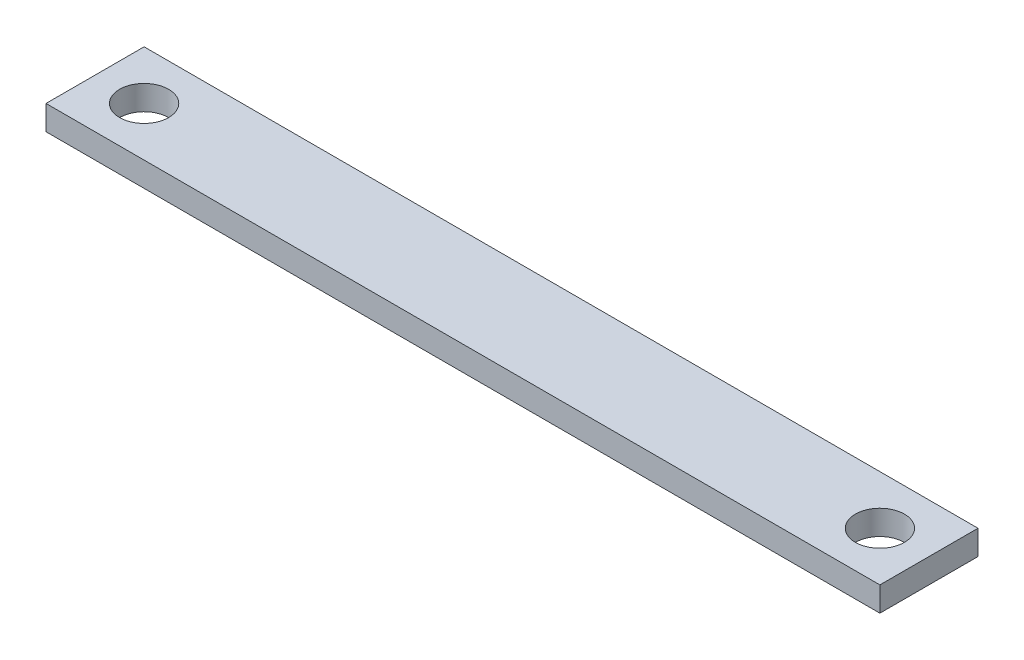
from build123d import *

# Parameters (mm, degrees)
SKETCH1_W           = 215.9
SKETCH1_H           = 25.4
SKETCH1_R           = 6.35
BOSS_EXTRUDE1_DEPTH = 6.35


with BuildPart() as part:
    # Sketch1 → Boss-Extrude1 (new body)
    with BuildSketch(Plane(origin=(0, 0, 0), x_dir=(1, 0, 0), z_dir=(0, 1, 0))):
        Rectangle(SKETCH1_W, SKETCH1_H)
        with Locations(Location((-95.25, 0, 0), (0, 0, 270))):
            Circle(SKETCH1_R, mode=Mode.SUBTRACT)
        with Locations(Location((95.25, 0, 0), (0, 0, 270))):
            Circle(SKETCH1_R, mode=Mode.SUBTRACT)
    extrude(amount=BOSS_EXTRUDE1_DEPTH)


solid = part.part
